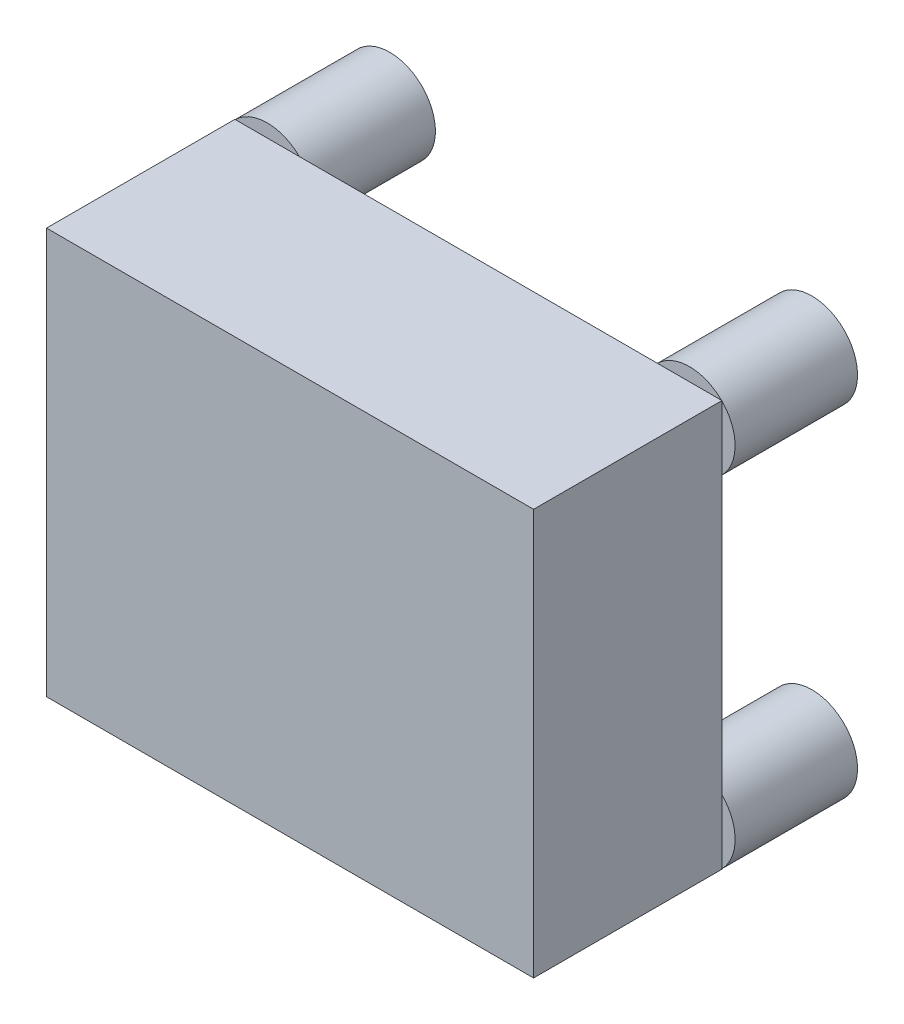
from build123d import *

# Parameters (mm, degrees)
SKETCH1_W           = 38.1
SKETCH1_H           = 31.75
BOSS_EXTRUDE1_DEPTH = 14.732
SKETCH2_R           = 3.5687
BOSS_EXTRUDE2_DEPTH = 9.5758
SKETCH3_R           = 1.3462
CUT_EXTRUDE1_DEPTH  = 8.89


with BuildPart() as part:
    # Sketch1 → Boss-Extrude1 (new body)
    with BuildSketch(Plane.XY):
        with Locations((19.05, 15.875)):
            Rectangle(SKETCH1_W, SKETCH1_H)
    extrude(amount=BOSS_EXTRUDE1_DEPTH)

    # Sketch2 → Boss-Extrude2 (add)
    with BuildSketch(Plane(origin=(0, 0, 0), x_dir=(-1, 0, 0), z_dir=(0, 0, -1))):
        with Locations(Location((-35.56, 2.54, 0), (0, 0, 224.623028882))):
            Circle(SKETCH2_R)
        with Locations(Location((-2.54, 2.54, 0), (0, 0, 225.376971118))):
            Circle(SKETCH2_R)
        with Locations(Location((-35.56, 29.21, 0), (0, 0, 135.376971118))):
            Circle(SKETCH2_R)
        with Locations(Location((-2.54, 29.21, 0), (0, 0, 134.623028882))):
            Circle(SKETCH2_R)
    extrude(amount=BOSS_EXTRUDE2_DEPTH)

    # Sketch3 → Cut-Extrude1 (cut)
    with BuildSketch(Plane(origin=(0, 0, -9.5758), x_dir=(-1, 0, 0), z_dir=(0, 0, -1))):
        with Locations((-35.56, 29.21)):
            Circle(SKETCH3_R)
        with Locations((-2.54, 29.21)):
            Circle(SKETCH3_R)
        with Locations((-2.54, 2.54)):
            Circle(SKETCH3_R)
        with Locations((-35.56, 2.54)):
            Circle(SKETCH3_R)
    extrude(amount=-CUT_EXTRUDE1_DEPTH, mode=Mode.SUBTRACT)


solid = part.part
